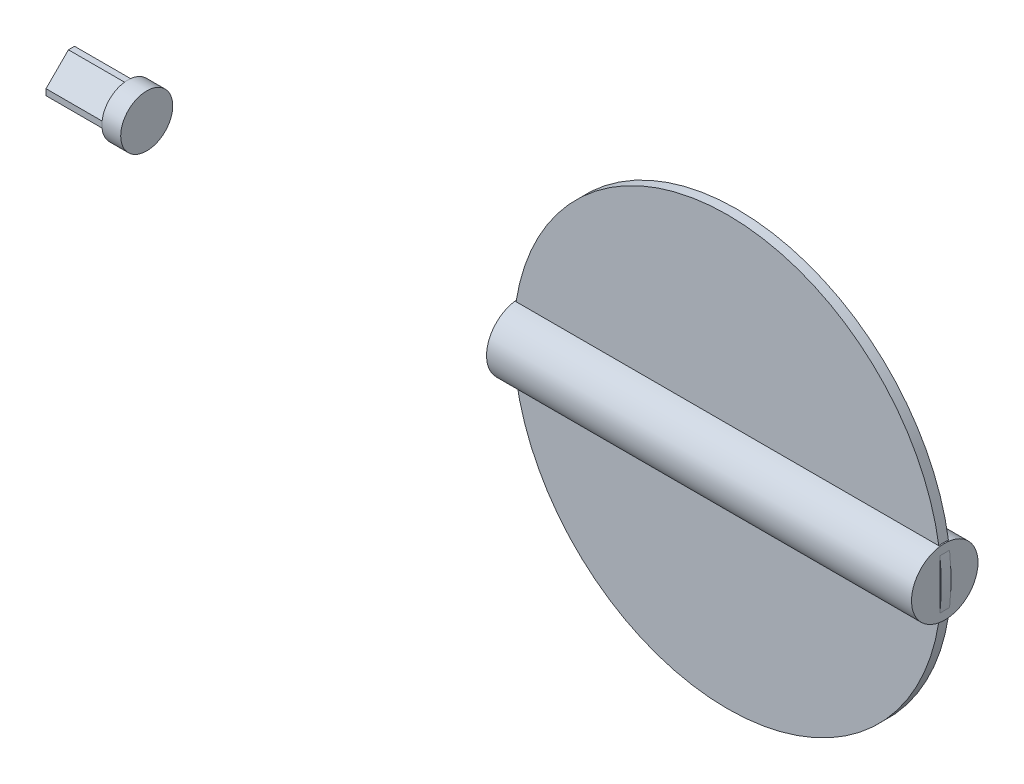
from build123d import *

# Parameters (mm, degrees)
HOLT_START                                     = -1.665
SKETCH1_R                                      = 74
HOLT_DISC_148_MM_DIAMETER_AND_3_33_MM_DEPTH    = 3.33
VISIBLE_START                                  = -73.5
SKETCH2_R                                      = 11.5
VISIBLE_STEM_23_MM_DIAMETER_WITH_RUNNI_DEPTH   = 147
UPPER_START                                    = -209.0719
SKETCH3_R                                      = 9
UPPER_STEM_COLLAR_AT_VALVE_FLANGE_DEPTH        = 6.52
HOLT_START_2                                   = -228.5719
HOLT_14_MM_SQUARE_DRIVE_WITH_CORNER_FLAT_DEPTH = 19.5


with BuildPart() as part:
    # Sketch1 → HOLT disc - 148 mm diameter and 3.33 mm thick (new body)
    with BuildSketch(Plane.XY.offset(HOLT_START)):
        Circle(SKETCH1_R)
    extrude(amount=HOLT_DISC_148_MM_DIAMETER_AND_3_33_MM_DEPTH)

    # Sketch2 → Visible stem - 23 mm diameter with running clearance (add)
    with BuildSketch(Plane(origin=(0, 0, 0), x_dir=(0, 0, -1), z_dir=(1, 0, 0)).offset(VISIBLE_START)):
        Circle(SKETCH2_R)
    extrude(amount=VISIBLE_STEM_23_MM_DIAMETER_WITH_RUNNI_DEPTH)


with BuildPart() as body_2:
    # Sketch3 → Upper stem collar at valve flange (new body)
    with BuildSketch(Plane(origin=(0, 0, 0), x_dir=(0, 0, -1), z_dir=(1, 0, 0)).offset(UPPER_START)):
        with Locations(Location((0, 0, 0), (0, 0, 180))):
            Circle(SKETCH3_R)
    extrude(amount=UPPER_STEM_COLLAR_AT_VALVE_FLANGE_DEPTH)

    # Sketch4 → HOLT 14 mm square drive with corner flats (add)
    with BuildSketch(Plane(origin=(0, 0, 0), x_dir=(0, 0, -1), z_dir=(1, 0, 0)).offset(HOLT_START_2)):
        Polygon((-8.82, 1.06), (-8.82, -1.06), (-1.06, -8.82), (1.06, -8.82), (8.82, -1.06), (8.82, 1.06), (1.06, 8.82), (-1.06, 8.82), align=None)
    extrude(amount=HOLT_14_MM_SQUARE_DRIVE_WITH_CORNER_FLAT_DEPTH)


solid = Compound([part.part, body_2.part])
